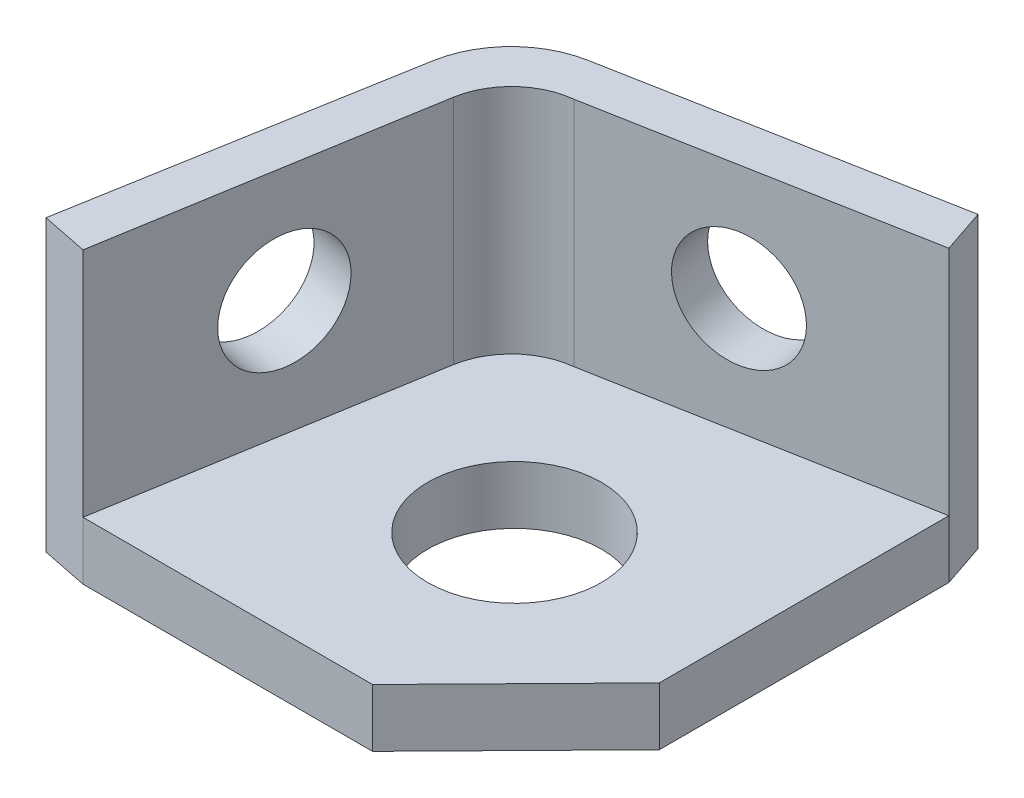
from build123d import *

# Parameters (mm, degrees)
SKETCH_1_R          = 15
EXTRUDE_1_DEPTH     = 10
EXTRUDE_2_DEPTH     = 50
SKETCH_3_R          = 10
CUT_EXTRUDE_1_DEPTH = 107.514235114
SKETCH_4_R          = 10
CUT_EXTRUDE_2_DEPTH = 101.948347169


with BuildPart() as part:
    # 草图1 → 凸台-拉伸1 (new body)
    with BuildSketch(Plane(origin=(0, 0, 0), x_dir=(1, 0, 0), z_dir=(0, 1, 0))):
        with BuildLine():
            Line((-28.57662693, 32.430036501), (-37.728647462, -22.372159091))
            Line((-37.728647462, -22.372159091), (12.271352538, -22.372159091))
            Line((12.271352538, -22.372159091), (36.78772041, 2.627840909))
            Line((36.78772041, 2.627840909), (36.78772041, 52.627840909))
            Line((36.78772041, 52.627840909), (-17.849431841, 42.537166231))
            ThreePointArc((-17.849431841, 42.537166231), (-24.914908418, 39.289889491), (-28.57662693, 32.430036501))
        make_face()
        with Locations((1.78772041, 12.627840909)):
            Circle(SKETCH_1_R, mode=Mode.SUBTRACT)
    extrude(amount=EXTRUDE_1_DEPTH)

    # 草图1<3> → 凸台-拉伸2 (add)
    with BuildSketch(Plane(origin=(0, 0, 0), x_dir=(1, 0, 0), z_dir=(0, 1, 0))):
        with BuildLine():
            Line((-45.728647462, -20.760800889), (-37.728647462, -22.372159091))
            Line((-37.728647462, -22.372159091), (-28.57662693, 32.430036501))
            ThreePointArc((-28.57662693, 32.430036501), (-24.914908418, 39.289889491), (-17.849431841, 42.537166231))
            Line((-17.849431841, 42.537166231), (36.78772041, 52.627840909))
            Line((36.78772041, 52.627840909), (34.234475122, 60.209459371))
            Line((34.234475122, 60.209459371), (-22.484150231, 49.56919577))
            ThreePointArc((-22.484150231, 49.56919577), (-31.249928384, 44.909957788), (-35.799091446, 36.086552513))
            Line((-35.799091446, 36.086552513), (-45.728647462, -20.760800889))
        make_face()
    extrude(amount=EXTRUDE_2_DEPTH)

    # 草图3 → 切除-拉伸1 (cut, through all)
    with BuildSketch(Plane(origin=(-40.855844778, 0, -7.136311104), x_dir=(-0.17206538860383633, 0, 0.9850855303193783), z_dir=(-0.9850855303193784, 0, -0.17206538860383633))):
        with Locations((-1.680517951, 30)):
            Circle(SKETCH_3_R)
    extrude(amount=-CUT_EXTRUDE_1_DEPTH, mode=Mode.SUBTRACT)

    # 草图4 → 切除-拉伸2 (cut, through all)
    with BuildSketch(Plane(origin=(-9.747294738, 0, -51.95859606), x_dir=(-0.9828548523659901, 0, 0.18438096208835575), z_dir=(-0.18438096208835575, 0, -0.9828548523659901))):
        with Locations((-14.748998038, 30)):
            Circle(SKETCH_4_R)
    extrude(amount=-CUT_EXTRUDE_2_DEPTH, mode=Mode.SUBTRACT)


solid = part.part
